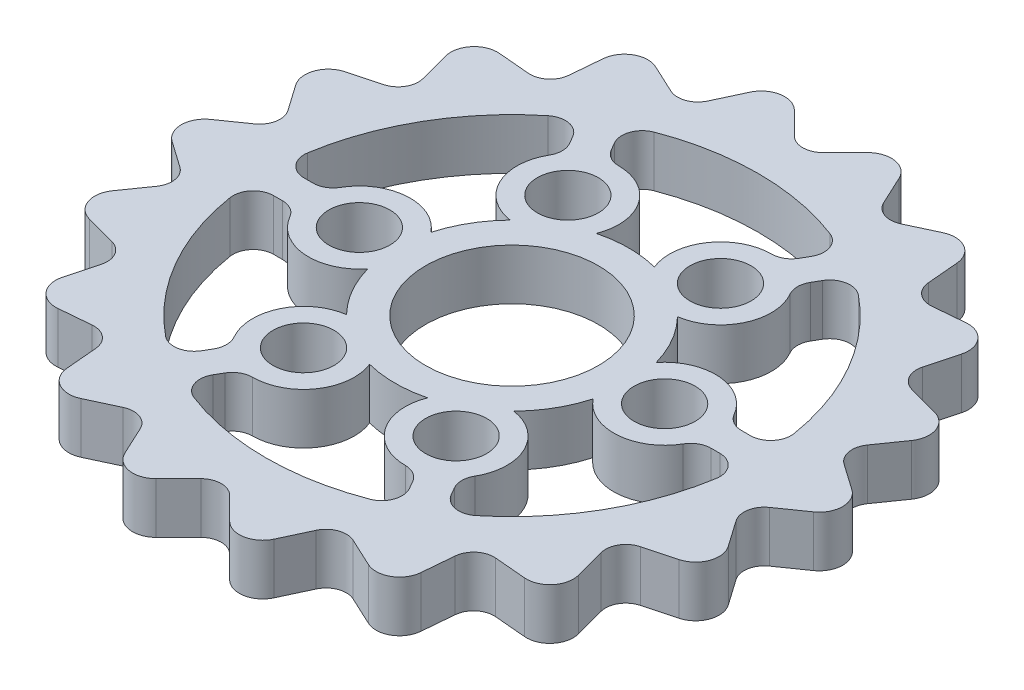
from build123d import *

# Parameters (mm, degrees)
BOSS_EXTRUDE1_DEPTH      = 3.175
CIRPATTERN1_COUNT        = 18
FILLET1_R                = 2.54
SKETCH2_R                = 10.795
SKETCH2_R_2              = 3.81
BOSS_EXTRUDE2_DEPTH      = 6.35
FILLET3_R                = 2.54
CIRPATTERN6_COUNT        = 6
FILLET3_OF_CIRPATTERN6_R = 2.54


with BuildPart() as part:
    # Sketch1 → Boss-Extrude1 (new, symmetric)
    with BuildSketch(Plane(origin=(0, 0, 0), x_dir=(1, 0, 0), z_dir=(0, 1, 0))):
        with BuildLine():
            Line((40.029416771, -2.392743121), (29.028555374, -10.095629198))
            ThreePointArc((29.028555374, -10.095629198), (30.734, 0), (29.028555374, 10.095629198))
            Line((29.028555374, 10.095629198), (40.029416771, 2.392743121))
            ThreePointArc((40.029416771, 2.392743121), (41.275, 0), (40.029416771, -2.392743121))
        make_face()
    boss_extrude1 = extrude(amount=BOSS_EXTRUDE1_DEPTH, both=True)

    # CirPattern1: Boss-Extrude1 ×18 about axis
    cirpattern1_axis = Axis((0, 0, 0), (0, 1, 0))
    for i in range(1, CIRPATTERN1_COUNT):
        add(boss_extrude1.rotate(cirpattern1_axis, i * 360 / CIRPATTERN1_COUNT))

    # Fillet1
    fillet1_edges = [part.edges().sort_by_distance(p)[0] for p in [
        (34.706724992, 0, 6.119732028),
        (34.706724992, 0, -6.119732028),
        (30.520581741, 0, 17.621066084),
        (22.653205897, 0, 26.997039511),
        (12.053519095, 0, 33.116771539),
        (0, 0, 35.242132168),
        (-12.053519095, 0, 33.116771539),
        (-22.653205897, 0, 26.997039511),
        (-30.520581741, 0, 17.621066084),
        (-34.706724992, 0, 6.119732028),
        (-34.706724992, 0, -6.119732028),
        (-30.520581741, 0, -17.621066084),
        (-22.653205897, 0, -26.997039511),
        (-12.053519095, 0, -33.116771539),
        (0, 0, -35.242132168),
        (12.053519095, 0, -33.116771539),
        (22.653205897, 0, -26.997039511),
        (30.520581741, 0, -17.621066084),
    ]]
    fillet(fillet1_edges, radius=FILLET1_R)

    # Sketch2 → Boss-Extrude2 (add)
    with BuildSketch(Plane(origin=(0, 3.175, 0), x_dir=(1, 0, 0), z_dir=(0, 1, 0))):
        with BuildLine():
            Line((30.674903928, 1.905), (25.107513929, 1.905))
            ThreePointArc((25.107513929, 1.905), (20.197480299, 6.245461469), (14.06525, 3.933798093))
            ThreePointArc((14.06525, 3.933798093), (-14.605, 0), (14.06525, -3.933798093))
            ThreePointArc((14.06525, -3.933798093), (20.197480299, -6.245461469), (25.107513929, -1.905))
            Line((25.107513929, -1.905), (30.674903928, -1.905))
            ThreePointArc((30.674903928, -1.905), (30.734, 0), (30.674903928, 1.905))
        make_face()
        with Locations(Location((0, 0, 0), (0, 0, 270))):
            Circle(SKETCH2_R, mode=Mode.SUBTRACT)
        with Locations(Location((19.05, 0, 0), (0, 0, 270))):
            Circle(SKETCH2_R_2, mode=Mode.SUBTRACT)
    boss_extrude2 = extrude(amount=-BOSS_EXTRUDE2_DEPTH)

    # Fillet3
    fillet3_edges = [part.edges().sort_by_distance(p)[0] for p in [
        (30.674903928, 0, -1.905),
        (30.674903928, 0, 1.905),
        (25.107513929, 0, 1.905),
        (25.107513929, 0, -1.905),
    ]]
    fillet(fillet3_edges, radius=FILLET3_R)

    # CirPattern6: Boss-Extrude2 ×6 about axis
    cirpattern6_axis = Axis((0, 0, 0), (0, 1, 0))
    for i in range(1, CIRPATTERN6_COUNT):
        add(boss_extrude2.rotate(cirpattern6_axis, i * 360 / CIRPATTERN6_COUNT))

    # Fillet3 of CirPattern6
    fillet3_of_cirpattern6_edges = [part.edges().sort_by_distance(p)[0] for p in [
        (13.68767357, 0, -27.51774606),
        (16.987230358, 0, -25.61274606),
        (14.203535359, 0, -20.791244888),
        (10.90397857, 0, -22.696244888),
        (-16.987230358, 0, -25.61274606),
        (-13.68767357, 0, -27.51774606),
        (-10.90397857, 0, -22.696244888),
        (-14.203535359, 0, -20.791244888),
        (-30.674903928, 0, 1.905),
        (-30.674903928, 0, -1.905),
        (-25.107513929, 0, -1.905),
        (-25.107513929, 0, 1.905),
        (-13.68767357, 0, 27.51774606),
        (-16.987230358, 0, 25.61274606),
        (-14.203535359, 0, 20.791244888),
        (-10.90397857, 0, 22.696244888),
        (16.987230358, 0, 25.61274606),
        (13.68767357, 0, 27.51774606),
        (10.90397857, 0, 22.696244888),
        (14.203535359, 0, 20.791244888),
    ]]
    fillet(fillet3_of_cirpattern6_edges, radius=FILLET3_OF_CIRPATTERN6_R)


solid = part.part
